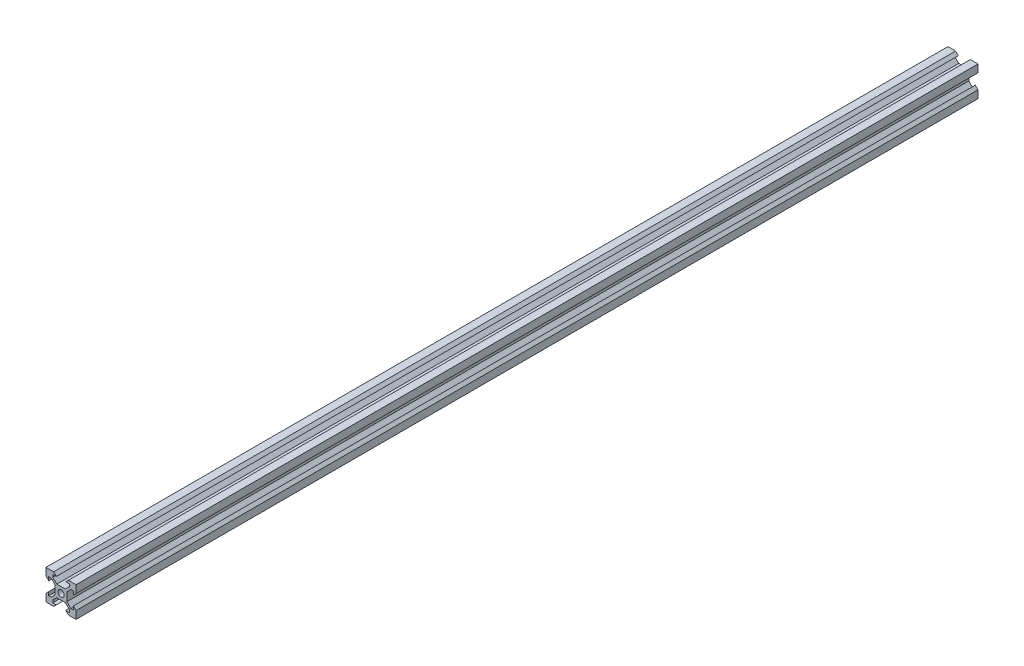
from build123d import *

# Parameters (mm, degrees)
ESQUISSE1_W             = 20
ESQUISSE1_H             = 20
BOSS_EXTRU_1_DEPTH      = 600
ENL_V_MAT_EXTRU_1_REACH = 602.287
ESQUISSE2_R             = 2.1


with BuildPart() as part:
    # Esquisse1 → Boss.-Extru.1 (new body)
    with BuildSketch(Plane.XY):
        with Locations((4.37228125, -1.733873274)):
            Rectangle(ESQUISSE1_W, ESQUISSE1_H)
    extrude(amount=BOSS_EXTRU_1_DEPTH)

    # Esquisse2 → Enlèv. mat.-Extru.1 (cut, up to next)
    with BuildSketch(Plane(origin=(0, 0, 0), x_dir=(-1, 0, 0), z_dir=(0, 0, -1)), mode=Mode.PRIVATE) as enl_v_mat_extru_1_sk1:
        with Locations((-4.37228125, -1.733873274)):
            Circle(ESQUISSE2_R)
    enl_v_mat_extru_1_tool1 = extrude(enl_v_mat_extru_1_sk1.sketch, amount=-ENL_V_MAT_EXTRU_1_REACH, mode=Mode.PRIVATE) & part.part
    # Esquisse2 → Enlèv. mat.-Extru.1 (cut, up to next)
    with BuildSketch(Plane(origin=(0, 0, 0), x_dir=(-1, 0, 0), z_dir=(0, 0, -1)), mode=Mode.PRIVATE) as enl_v_mat_extru_1_sk2:
        Polygon((-9.27228125, 8.266126726), (0.52771875, 8.266126726), (-1.27228125, 6.466126726), (1.12771875, 6.466126726), (1.12771875, 4.826126726), (-1.53228125, 2.166126726), (-7.21228125, 2.166126726), (-9.87228125, 4.826126726), (-9.87228125, 6.466126726), (-7.47228125, 6.466126726), align=None)
    enl_v_mat_extru_1_tool2 = extrude(enl_v_mat_extru_1_sk2.sketch, amount=-ENL_V_MAT_EXTRU_1_REACH, mode=Mode.PRIVATE) & part.part
    # Esquisse2 → Enlèv. mat.-Extru.1 (cut, up to next)
    with BuildSketch(Plane(origin=(0, 0, 0), x_dir=(-1, 0, 0), z_dir=(0, 0, -1)), mode=Mode.PRIVATE) as enl_v_mat_extru_1_sk3:
        Polygon((2.18771875, -7.233873274), (-0.47228125, -4.573873274), (-0.47228125, 1.106126726), (2.18771875, 3.766126726), (3.82771875, 3.766126726), (3.82771875, 1.366126726), (5.62771875, 3.166126726), (5.62771875, -6.633873274), (3.82771875, -4.833873274), (3.82771875, -7.233873274), align=None)
    enl_v_mat_extru_1_tool3 = extrude(enl_v_mat_extru_1_sk3.sketch, amount=-ENL_V_MAT_EXTRU_1_REACH, mode=Mode.PRIVATE) & part.part
    # Esquisse2 → Enlèv. mat.-Extru.1 (cut, up to next)
    with BuildSketch(Plane(origin=(0, 0, 0), x_dir=(-1, 0, 0), z_dir=(0, 0, -1)), mode=Mode.PRIVATE) as enl_v_mat_extru_1_sk4:
        Polygon((-9.87228125, -8.293873274), (-7.21228125, -5.633873274), (-1.53228125, -5.633873274), (1.12771875, -8.293873274), (1.12771875, -9.933873274), (-1.27228125, -9.933873274), (0.52771875, -11.733873274), (-9.27228125, -11.733873274), (-7.47228125, -9.933873274), (-9.87228125, -9.933873274), align=None)
    enl_v_mat_extru_1_tool4 = extrude(enl_v_mat_extru_1_sk4.sketch, amount=-ENL_V_MAT_EXTRU_1_REACH, mode=Mode.PRIVATE) & part.part
    # Esquisse2 → Enlèv. mat.-Extru.1 (cut, up to next)
    with BuildSketch(Plane(origin=(0, 0, 0), x_dir=(-1, 0, 0), z_dir=(0, 0, -1)), mode=Mode.PRIVATE) as enl_v_mat_extru_1_sk5:
        Polygon((-10.93228125, 3.766126726), (-8.27228125, 1.106126726), (-8.27228125, -4.573873274), (-10.93228125, -7.233873274), (-12.57228125, -7.233873274), (-12.57228125, -4.833873274), (-14.37228125, -6.633873274), (-14.37228125, 3.166126726), (-12.57228125, 1.366126726), (-12.57228125, 3.766126726), align=None)
    enl_v_mat_extru_1_tool5 = extrude(enl_v_mat_extru_1_sk5.sketch, amount=-ENL_V_MAT_EXTRU_1_REACH, mode=Mode.PRIVATE) & part.part
    add(enl_v_mat_extru_1_tool1.solids().sort_by_distance((4.372281, -1.733873, 0))[0], mode=Mode.SUBTRACT)
    add(enl_v_mat_extru_1_tool2.solids().sort_by_distance((4.372281, 5.301599, 0))[0], mode=Mode.SUBTRACT)
    add(enl_v_mat_extru_1_tool3.solids().sort_by_distance((-2.663191, -1.733873, 0))[0], mode=Mode.SUBTRACT)
    add(enl_v_mat_extru_1_tool4.solids().sort_by_distance((4.372281, -8.769346, 0))[0], mode=Mode.SUBTRACT)
    add(enl_v_mat_extru_1_tool5.solids().sort_by_distance((11.407754, -1.733873, 0))[0], mode=Mode.SUBTRACT)


solid = part.part
